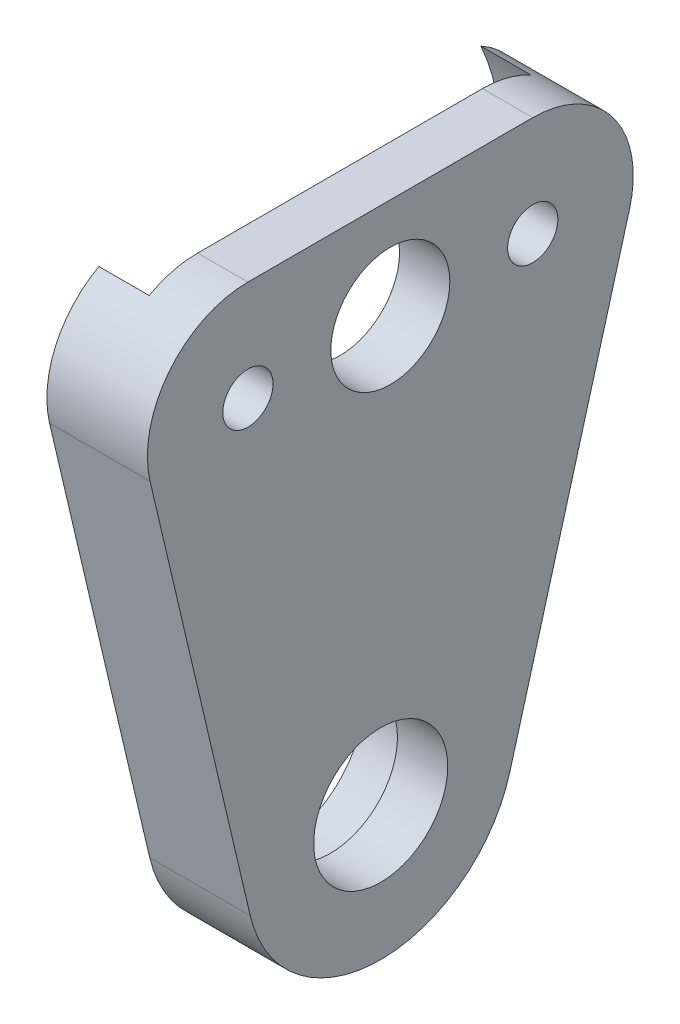
from build123d import *

# Parameters (mm, degrees)
SKETCH1_R           = 3.55
SKETCH1_R_2         = 1.5
SKETCH1_R_3         = 4
BOSS_EXTRUDE1_DEPTH = 6
SKETCH2_R           = 4.99
CUT_EXTRUDE1_DEPTH  = 3
SKETCH3_R           = 12.55
CUT_EXTRUDE2_DEPTH  = 3


with BuildPart() as part:
    # Sketch1 → Boss-Extrude1 (new body)
    with BuildSketch(Plane(origin=(0, 0, 0), x_dir=(0, 0, -1), z_dir=(1, 0, 0))):
        with BuildLine():
            Line((30.431712199, 18), (13.431712199, 18))
            ThreePointArc((13.431712199, 18), (8.728856289, 15.726009432), (7.590750373, 10.627715428))
            Line((7.590750373, 10.627715428), (13.570211844, -14.823132675))
            ThreePointArc((13.570211844, -14.823132675), (21.189386747, -20.991639419), (29.061992727, -15.150032042))
            Line((29.061992727, -15.150032042), (36.209586036, 10.382540903))
            ThreePointArc((36.209586036, 10.382540903), (35.212128216, 15.625965073), (30.431712199, 18))
        make_face()
        with Locations((21.931712199, 12)):
            Circle(SKETCH1_R, mode=Mode.SUBTRACT)
        with Locations((30.431712199, 12)):
            Circle(SKETCH1_R_2, mode=Mode.SUBTRACT)
        with Locations((13.431712199, 12)):
            Circle(SKETCH1_R_2, mode=Mode.SUBTRACT)
        with Locations((21.358160945, -12.993419913)):
            Circle(SKETCH1_R_3, mode=Mode.SUBTRACT)
    extrude(amount=BOSS_EXTRUDE1_DEPTH)

    # Sketch2 → Cut-Extrude1 (cut)
    with BuildSketch(Plane(origin=(0, 0, 0), x_dir=(0, 0, -1), z_dir=(1, 0, 0))):
        with Locations((21.358160945, -12.993419913)):
            Circle(SKETCH2_R)
    extrude(amount=CUT_EXTRUDE1_DEPTH, mode=Mode.SUBTRACT)

    # Sketch3 → Cut-Extrude2 (cut)
    with BuildSketch(Plane(origin=(0, 0, 0), x_dir=(0, 0, -1), z_dir=(1, 0, 0))):
        with Locations((21.931712199, 12)):
            Circle(SKETCH3_R)
    extrude(amount=CUT_EXTRUDE2_DEPTH, mode=Mode.SUBTRACT)


solid = part.part
